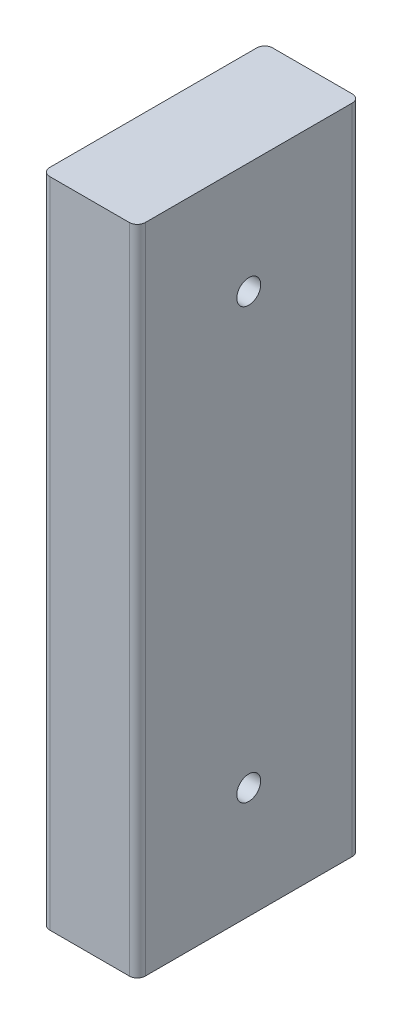
from build123d import *

# Parameters (mm, degrees)
SKETCH1_W                  = 88.9
SKETCH1_H                  = 260.35
BOSS_EXTRUDE1_DEPTH        = 19.05
FILLET1_R                  = 3.175
F_3_8_0_3750_DOWEL_HOLE1_D = 9.525


with BuildPart() as part:
    # Sketch1 → Boss-Extrude1 (new, symmetric)
    with BuildSketch(Plane(origin=(0, 0, 0), x_dir=(0, 0, -1), z_dir=(1, 0, 0))):
        with Locations((44.45, 130.175)):
            Rectangle(SKETCH1_W, SKETCH1_H)
    extrude(amount=BOSS_EXTRUDE1_DEPTH, both=True)

    # Fillet1
    fillet1_edges = [part.edges().sort_by_distance(p)[0] for p in [
        (19.05, 130.175, 0),
        (-19.05, 130.175, 0),
        (-19.05, 130.175, -88.9),
        (19.05, 130.175, -88.9),
    ]]
    fillet(fillet1_edges, radius=FILLET1_R)

    # 3/8 (0.3750) Dowel Hole1 (through all)
    with Locations(Plane.ZY.offset(19.05)):
        with Locations((-44.45, 215.9), (-44.45, 44.45)):
            Hole(F_3_8_0_3750_DOWEL_HOLE1_D / 2)


solid = part.part
